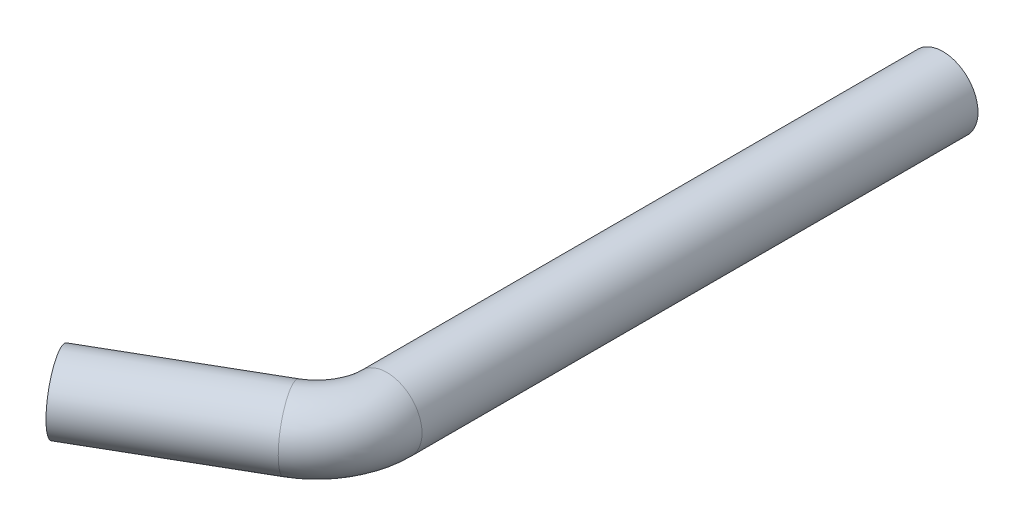
from build123d import *

# Parameters (mm, degrees)
SKETCH1_R = 5


with BuildPart() as part:
    # Sweep1: sweep along a path in Sketch4
    with BuildLine(Plane(origin=(0, 0, 0), x_dir=(1, 0, 0), z_dir=(0, 1, 0))) as sweep1_path:
        Line((0, 0), (0, -79.226497308))
        ThreePointArc((0, -79.226497308), (-1.339745962, -84.226497308), (-5, -87.886751346))
        Line((-5, -87.886751346), (-25.980762114, -100))
    # Sketch1 → Sweep1 (sweep)
    with BuildSketch(Plane.XY):
        Circle(SKETCH1_R)
    sweep(path=sweep1_path.line)


solid = part.part
